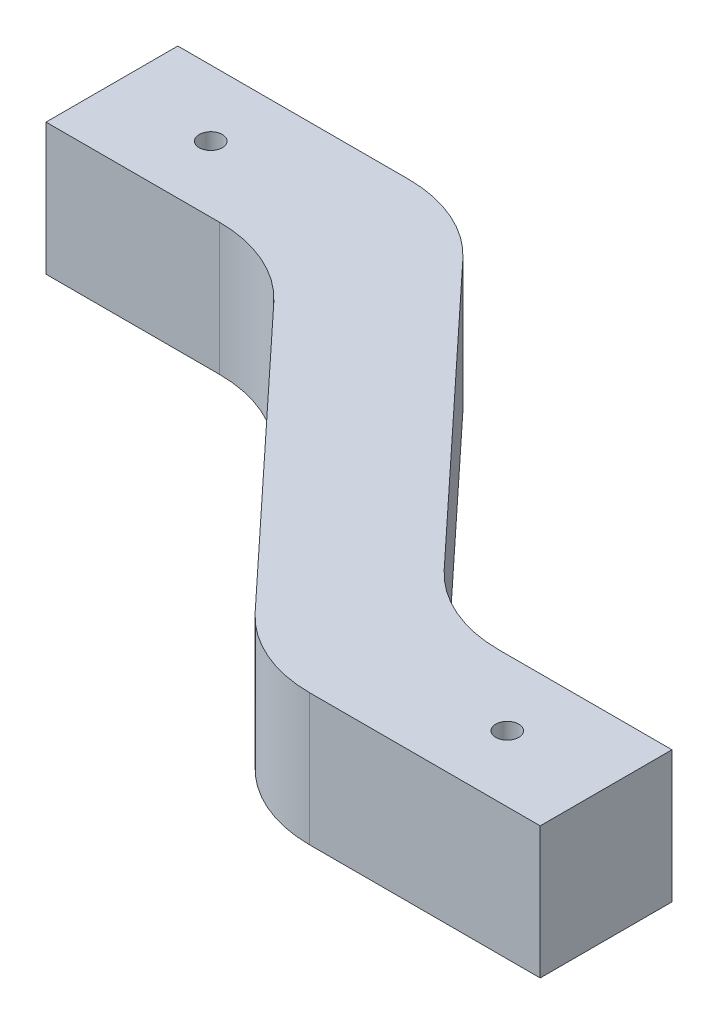
from build123d import *

# Parameters (mm, degrees)
CROQUIS1_R              = 1.75
SALIENTE_EXTRUIR1_DEPTH = 20
REDONDEO1_R             = 20


with BuildPart() as part:
    # Croquis1 → Saliente-Extruir1 (new body)
    with BuildSketch(Plane(origin=(0, 0, 0), x_dir=(1, 0, 0), z_dir=(0, 1, 0))):
        Polygon((-65, 0), (-21.305768696, 0), (30, -55), (65, -55), (65, -75), (21.305768696, -75), (-30, -20), (-65, -20), align=None)
        with Locations(Location((-50, -10, 0), (0, 0, 270))):
            Circle(CROQUIS1_R, mode=Mode.SUBTRACT)
        with Locations(Location((50, -65, 0), (0, 0, 270))):
            Circle(CROQUIS1_R, mode=Mode.SUBTRACT)
    extrude(amount=SALIENTE_EXTRUIR1_DEPTH)

    # Redondeo1
    redondeo1_edges = [part.edges().sort_by_distance(p)[0] for p in [
        (-21.305768696, 10, 0),
        (30, 10, 55),
        (21.305768696, 10, 75),
        (-30, 10, 20),
    ]]
    fillet(redondeo1_edges, radius=REDONDEO1_R)


solid = part.part
